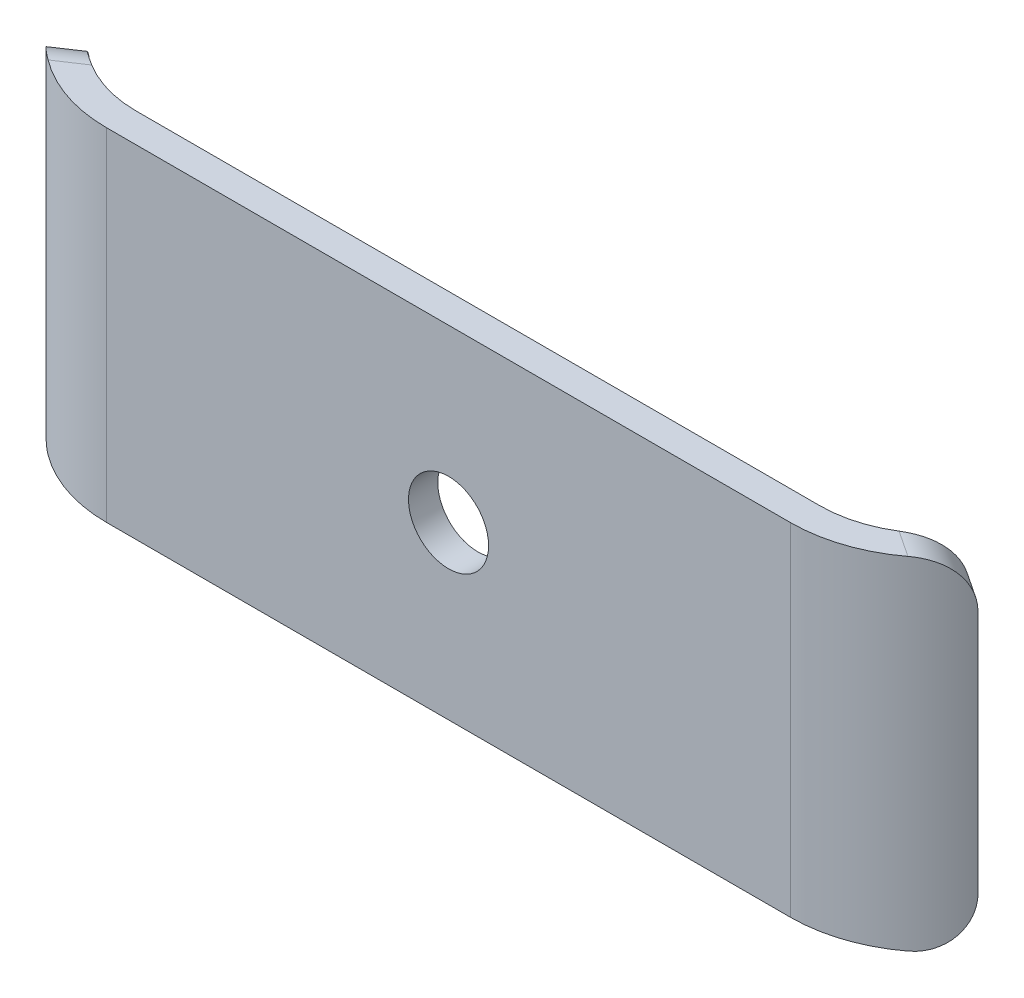
from build123d import *

# Parameters (mm, degrees)
BOSS_EXTRUDE1_DEPTH = 35
FILLET1_R           = 5
CUT_EXTRUDE1_REACH  = 61.592
SKETCH2_R           = 4.1


with BuildPart() as part:
    # Sketch1 → Boss-Extrude1 (new body)
    with BuildSketch(Plane(origin=(0, 0, 0), x_dir=(1, 0, 0), z_dir=(0, 1, 0))):
        with BuildLine():
            ThreePointArc((-35, -12), (-40.674548662, -10.573528147), (-45, -6.633249581))
            Line((-45, -6.633249581), (-47.5, -8.291561976))
            ThreePointArc((-47.5, -8.291561976), (-42.093185827, -13.216910184), (-35, -15))
            Line((-35, -15), (35, -15))
            ThreePointArc((35, -15), (42.093185827, -13.216910184), (47.5, -8.291561976))
            Line((47.5, -8.291561976), (45, -6.633249581))
            ThreePointArc((45, -6.633249581), (40.674548662, -10.573528147), (35, -12))
            Line((35, -12), (-35, -12))
        make_face()
    extrude(amount=BOSS_EXTRUDE1_DEPTH)

    # Fillet1
    fillet1_edges = [part.edges().sort_by_distance(p)[0] for p in [
        (46.25, 0, 7.462405778),
        (-46.25, 0, 7.462405778),
        (46.25, 35, 7.462405778),
        (-46.25, 35, 7.462405778),
    ]]
    fillet(fillet1_edges, radius=FILLET1_R)

    # Sketch2 → Cut-Extrude1 (cut, up to next)
    with BuildSketch(Plane.XY.offset(15), mode=Mode.PRIVATE) as cut_extrude1_sk1:
        with Locations((0, 17.5)):
            Circle(SKETCH2_R)
    cut_extrude1_tool1 = extrude(cut_extrude1_sk1.sketch, amount=-CUT_EXTRUDE1_REACH, mode=Mode.PRIVATE) & part.part
    add(cut_extrude1_tool1.solids().sort_by_distance((0, 17.5, 15))[0], mode=Mode.SUBTRACT)


solid = part.part
